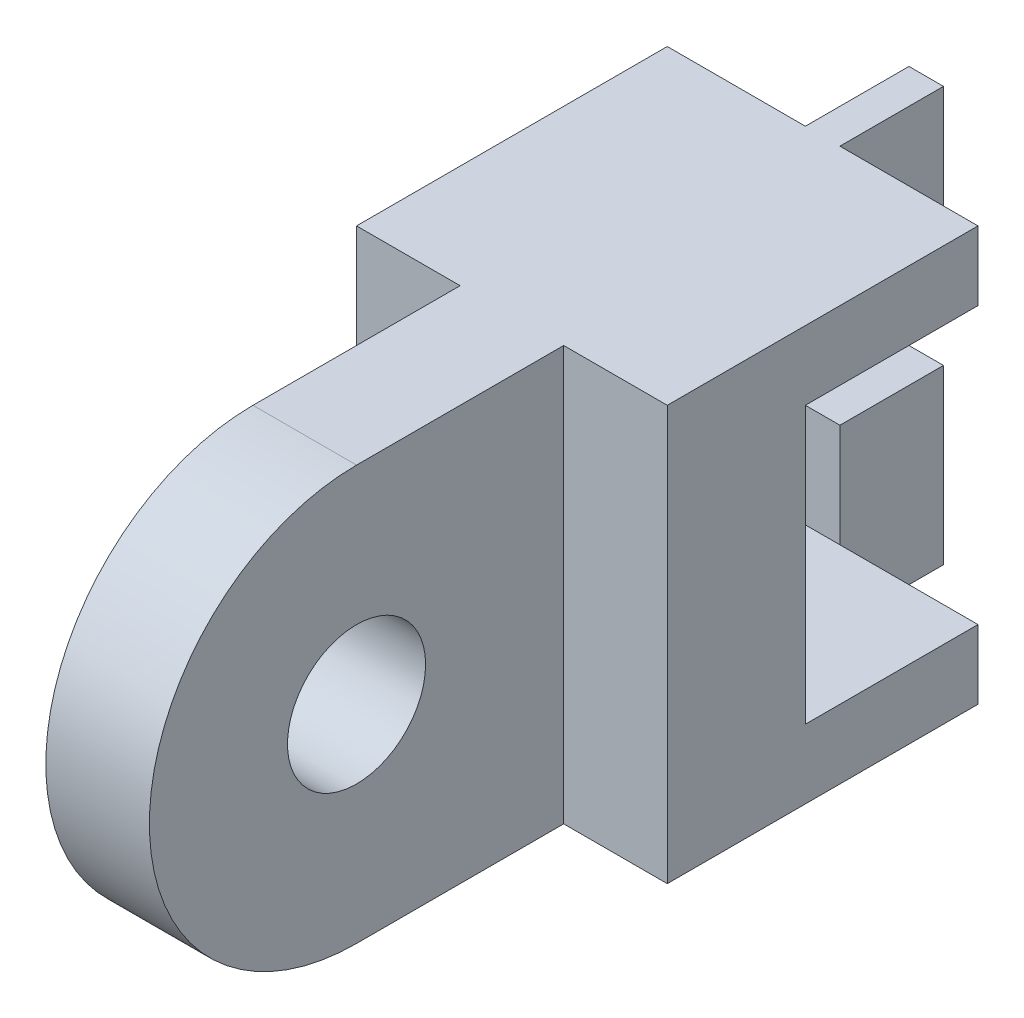
from build123d import *

# Parameters (mm, degrees)
BOSS_EXTRUDE1_DEPTH      = 37.5
BOSS_EXTRUDE1_DEPTH_BACK = 37.5
SKETCH2_R                = 50
BOSS_EXTRUDE2_DEPTH      = 112.5
BOSS_EXTRUDE2_DEPTH_BACK = 112.5
BOSS_EXTRUDE3_DEPTH      = 12.5
BOSS_EXTRUDE3_DEPTH_BACK = 12.5
BOSS_EXTRUDE4_DEPTH      = 12.5
BOSS_EXTRUDE4_DEPTH_BACK = 12.5


with BuildPart() as part:
    # Sketch2 → Boss-Extrude1 (new, two sides: drawn at the far end of the back side and taken through both)
    with BuildSketch(Plane(origin=(0, 0, 0), x_dir=(0, 0, -1), z_dir=(1, 0, 0)).offset(-BOSS_EXTRUDE1_DEPTH_BACK)):
        with BuildLine():
            Line((150, 150), (0, 150))
            ThreePointArc((0, 150), (-150, 0), (0, -150))
            Line((0, -150), (150, -150))
            Line((150, -150), (150, 150))
        make_face()
        Circle(SKETCH2_R, mode=Mode.SUBTRACT)
    extrude(amount=BOSS_EXTRUDE1_DEPTH + BOSS_EXTRUDE1_DEPTH_BACK)

    # Sketch2<12> → Boss-Extrude2 (add, two sides: drawn at the far end of the back side and taken through both)
    with BuildSketch(Plane(origin=(0, 0, 0), x_dir=(0, 0, -1), z_dir=(1, 0, 0)).offset(-BOSS_EXTRUDE2_DEPTH_BACK)):
        Polygon((375, 150), (150, 150), (150, -150), (375, -150), (375, -100), (250, -100), (250, 100), (375, 100), align=None)
    extrude(amount=BOSS_EXTRUDE2_DEPTH + BOSS_EXTRUDE2_DEPTH_BACK)

    # Sketch2<13> → Boss-Extrude3 (add, two sides: drawn at the far end of the back side and taken through both)
    with BuildSketch(Plane(origin=(0, 0, 0), x_dir=(0, 0, -1), z_dir=(1, 0, 0)).offset(-BOSS_EXTRUDE3_DEPTH_BACK)):
        Polygon((450, 150), (375, 150), (375, 100), (375, 75), (450, 75), align=None)
    extrude(amount=BOSS_EXTRUDE3_DEPTH + BOSS_EXTRUDE3_DEPTH_BACK)

    # Sketch2<14> → Boss-Extrude4 (add, two sides: drawn at the far end of the back side and taken through both)
    with BuildSketch(Plane(origin=(0, 0, 0), x_dir=(0, 0, -1), z_dir=(1, 0, 0)).offset(-BOSS_EXTRUDE4_DEPTH_BACK)):
        Polygon((375, -100), (375, -150), (450, -150), (450, -25), (375, -25), align=None)
    extrude(amount=BOSS_EXTRUDE4_DEPTH + BOSS_EXTRUDE4_DEPTH_BACK)


solid = part.part
